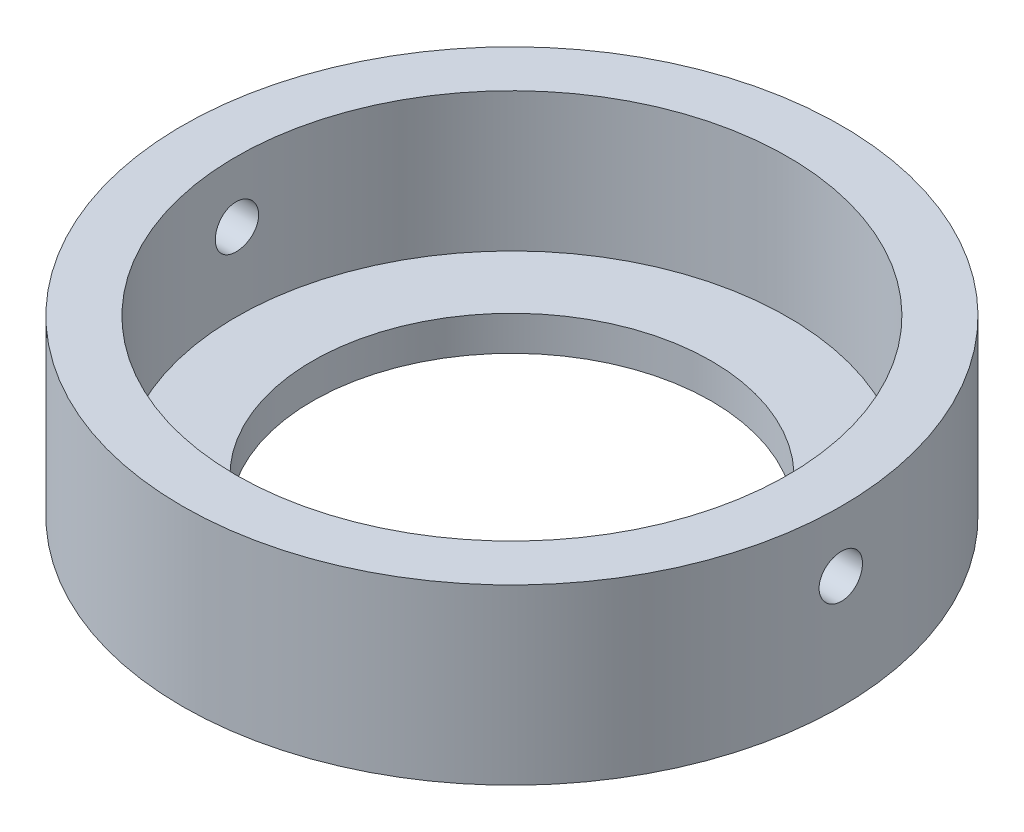
from build123d import *

# Parameters (mm, degrees)
SKETCH_1_R          = 19
EXTRUDE_1_DEPTH     = 2
SKETCH_2_R          = 19
SKETCH_2_R_2        = 15.9
EXTRUDE_2_DEPTH     = 8
SKETCH_3_R          = 11.5
CUT_EXTRUDE_1_DEPTH = 6


with BuildPart() as part:
    # 草图1 → 凸台-拉伸1 (new body)
    with BuildSketch(Plane(origin=(0, 0, 0), x_dir=(1, 0, 0), z_dir=(0, 1, 0))):
        with Locations(Location((0, 0, 0), (0, 0, 270))):
            Circle(SKETCH_1_R)
    extrude(amount=EXTRUDE_1_DEPTH)

    # 草图2 → 凸台-拉伸2 (add)
    with BuildSketch(Plane(origin=(0, 2, 0), x_dir=(1, 0, 0), z_dir=(0, 1, 0))):
        with Locations(Location((0, 0, 0), (0, 0, 270))):
            Circle(SKETCH_2_R)
        with Locations(Location((0, 0, 0), (0, 0, 270))):
            Circle(SKETCH_2_R_2, mode=Mode.SUBTRACT)
    extrude(amount=EXTRUDE_2_DEPTH)

    # 草图3 → 切除-拉伸1 (cut)
    with BuildSketch(Plane.XZ):
        with Locations(Location((0, 0, 0), (0, 0, 270))):
            Circle(SKETCH_3_R)
    extrude(amount=-CUT_EXTRUDE_1_DEPTH, mode=Mode.SUBTRACT)

    # 草图10 → M3 螺纹孔1 (revolve, cut)
    with BuildSketch(Plane(origin=(-19, 6.5, 0), x_dir=(0, 0, 1), z_dir=(0, 1, 0))):
        Polygon((0, 0), (0, 44.651075774), (1.25, 43.9), (1.25, 0.275), (1.525, 0), align=None)
    revolve(axis=Axis((-25.35, 6.5, 0), (1, 0, 0)), mode=Mode.SUBTRACT)


solid = part.part
